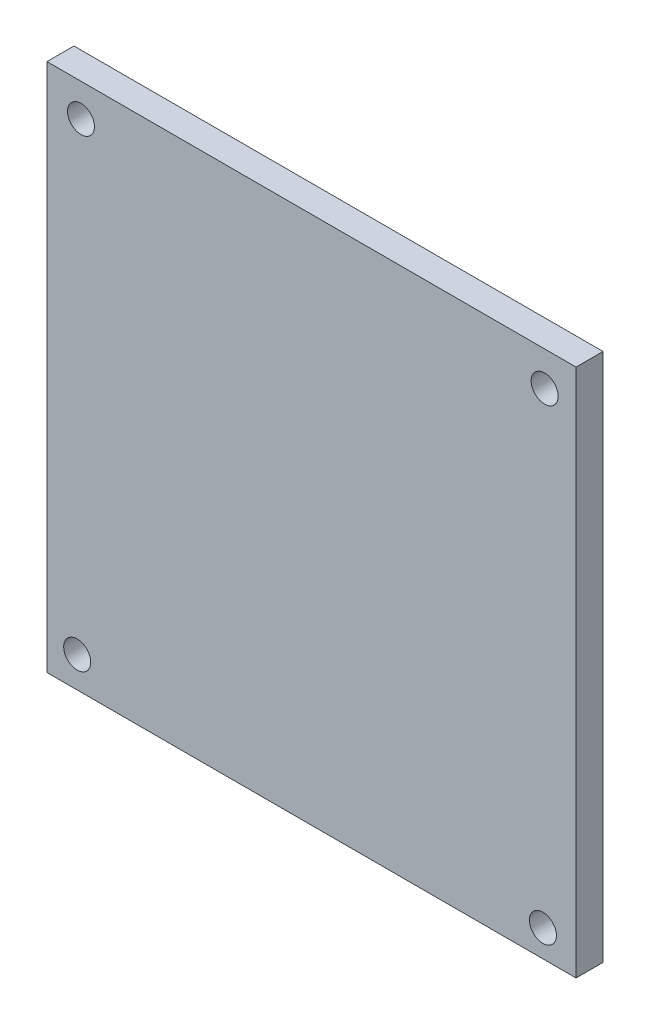
from build123d import *

# Parameters (mm, degrees)
SKETCH1_W           = 49.784
SKETCH1_H           = 49.784
BOSS_EXTRUDE1_DEPTH = 2.54
SKETCH2_R           = 1.27
CUT_EXTRUDE1_DEPTH  = 36.294120304


with BuildPart() as part:
    # Sketch1 → Boss-Extrude1 (new body)
    with BuildSketch(Plane.XY):
        Rectangle(SKETCH1_W, SKETCH1_H)
    extrude(amount=BOSS_EXTRUDE1_DEPTH)

    # Sketch2 → Cut-Extrude1 (cut, through all)
    with BuildSketch(Plane.XY.offset(2.54)):
        with Locations((-21.688499139, 21.818469938)):
            Circle(SKETCH2_R)
        with Locations((-22.0472, -22.003711907)):
            Circle(SKETCH2_R)
        with Locations((21.774981845, -22.362412768)):
            Circle(SKETCH2_R)
        with Locations((21.934472809, 21.661343147)):
            Circle(SKETCH2_R)
    extrude(amount=-CUT_EXTRUDE1_DEPTH, mode=Mode.SUBTRACT)


solid = part.part
